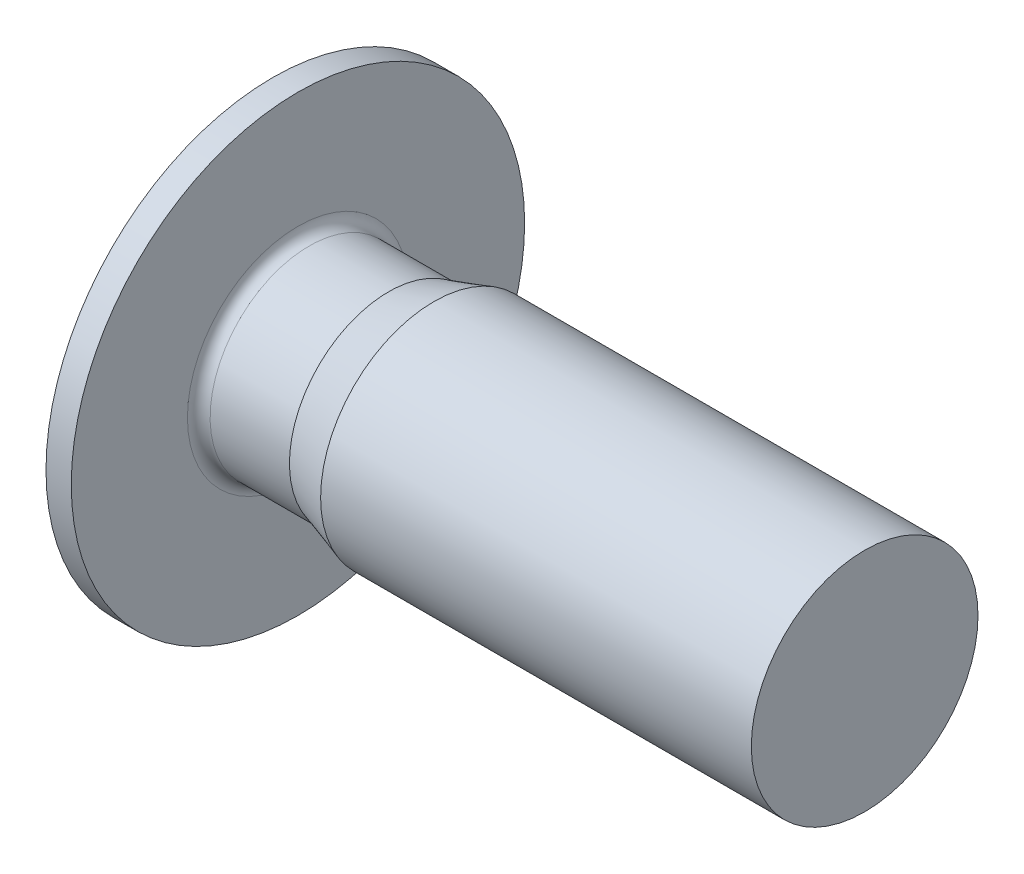
from build123d import *

# Parameters (mm, degrees)
FILLET1_R          = 0.1
CUT_EXTRUDE1_DEPTH = 1.2


with BuildPart() as part:
    # Sketch1 → Revolve1 (revolve)
    with BuildSketch(Plane.XY, mode=Mode.PRIVATE) as revolve1_sk:
        Polygon((-0.5, 0), (-0.5, 1.52), (-0.222871871, 2), (0, 2), (0, 0.875), (0.8, 0.875), (1.2, 1), (5, 1), (5, 0), align=None)
    revolve(revolve1_sk.sketch.rotate(Axis((-0.5, 0, 0), (1, 0, 0)), 180), axis=Axis((-0.5, 0, 0), (1, 0, 0)))

    # Fillet1
    fillet1_edges = [part.edges().sort_by_distance(p)[0] for p in [
        (0, 0.875, 0),
    ]]
    fillet(fillet1_edges, radius=FILLET1_R)

    # Sketch2 → Cut-Extrude1 (cut)
    with BuildSketch(Plane.ZY.offset(0.5)):
        Polygon((0, 0.75055535), (-0.65, 0.375277675), (-0.65, -0.375277675), (0, -0.75055535), (0.65, -0.375277675), (0.65, 0.375277675), align=None)
    extrude(amount=-CUT_EXTRUDE1_DEPTH, mode=Mode.SUBTRACT)

    # Sketch3 → Cut-Revolve1 (revolve, cut)
    with BuildSketch(Plane.XY, mode=Mode.PRIVATE) as cut_revolve1_sk:
        Polygon((0.7, 0), (0.7, 0.65), (1.090559402, 0), align=None)
    revolve(cut_revolve1_sk.sketch.rotate(Axis((0.7, 0, 0), (1, 0, 0)), 180), axis=Axis((0.7, 0, 0), (1, 0, 0)), mode=Mode.SUBTRACT)


solid = part.part
